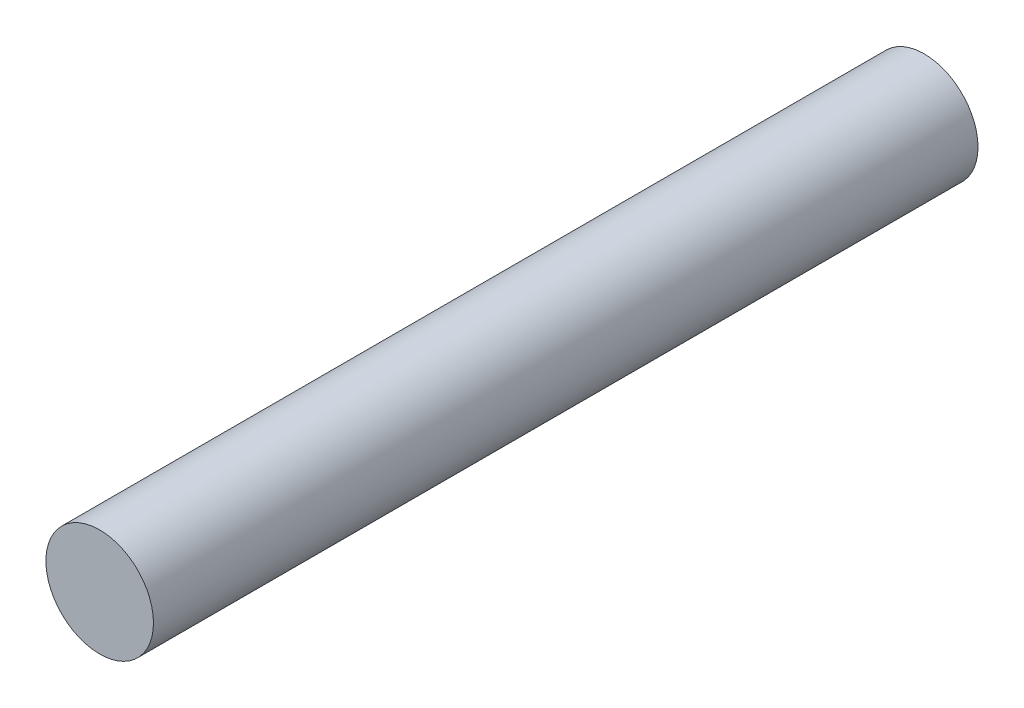
from build123d import *

# Parameters (mm, degrees)
SKETCH_1_R      = 3
EXTRUDE_1_DEPTH = 46


with BuildPart() as part:
    # 스케치1 → 보스-돌출1 (new body)
    with BuildSketch(Plane.XY):
        Circle(SKETCH_1_R)
    extrude(amount=EXTRUDE_1_DEPTH)


solid = part.part
